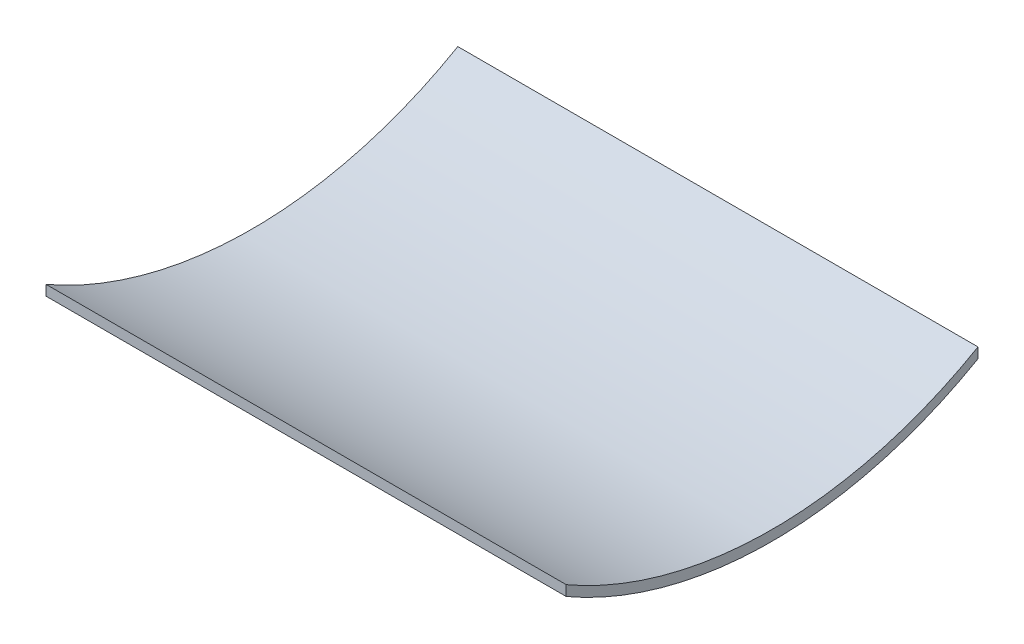
from build123d import *

# Parameters (mm, degrees)
BOSS_EXTRUDE4_DEPTH = 304.8


with BuildPart() as part:
    # Sketch3 → Boss-Extrude4 (new body)
    with BuildSketch(Plane(origin=(0, 0, 0), x_dir=(0, 0, -1), z_dir=(1, 0, 0))):
        with BuildLine():
            ThreePointArc((232.90669496, 1.961354585), (112.25669496, -30.366715482), (-8.39330504, 1.961354585))
            Line((-8.39330504, 1.961354585), (-8.39330504, -4.052041589))
            ThreePointArc((-8.39330504, -4.052041589), (112.25669496, -36.380111656), (232.90669496, -4.052041589))
            Line((232.90669496, -4.052041589), (232.90669496, 1.961354585))
        make_face()
    extrude(amount=BOSS_EXTRUDE4_DEPTH)


solid = part.part
